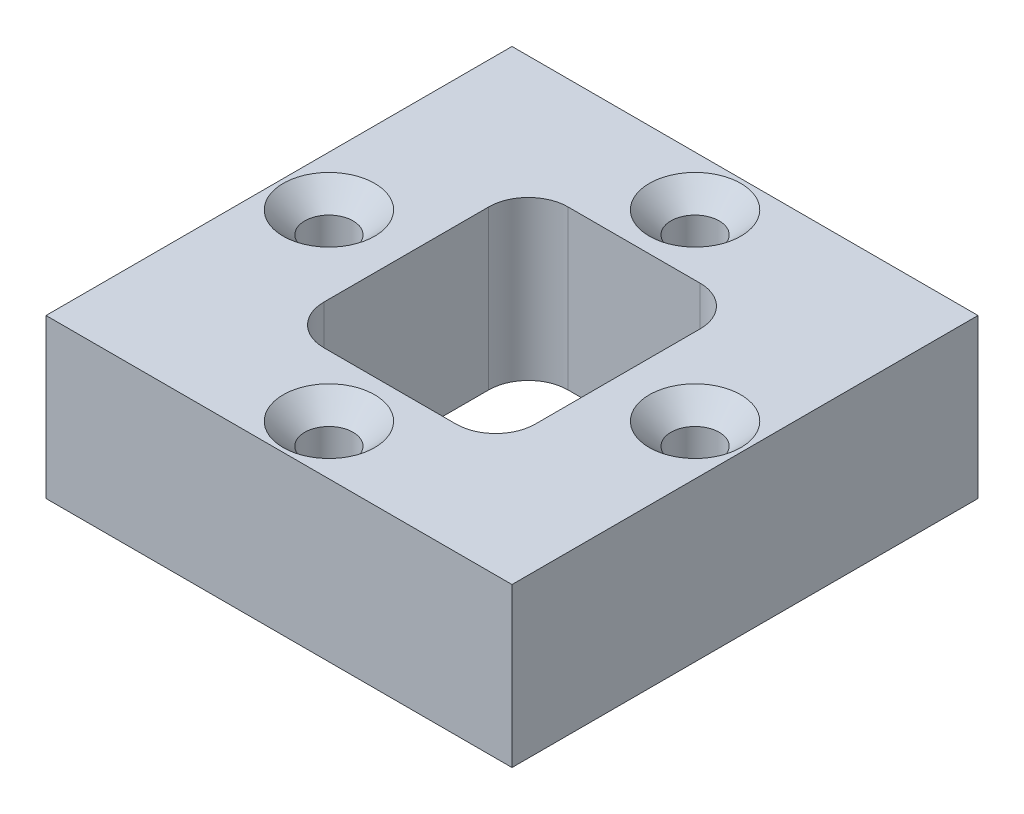
from build123d import *

# Parameters (mm, degrees)
SKETCH2_W                                         = 28
SKETCH2_H                                         = 28
BOSS_EXTRUDE1_DEPTH                               = 9.525
SKETCH6_W                                         = 12.7
SKETCH6_H                                         = 14.66469
CUT_EXTRUDE3_DEPTH                                = 9.525
FILLET1_R                                         = 2.38125
CSK_FOR_M2_5_FLAT_HEAD_MACHINE_SCREW1_D           = 2.9
CSK_FOR_M2_5_FLAT_HEAD_MACHINE_SCREW1_DEPTH       = 10.16
CSK_FOR_M2_5_FLAT_HEAD_MACHINE_SCREW1_CSINK_D     = 5.5
CSK_FOR_M2_5_FLAT_HEAD_MACHINE_SCREW1_CSINK_ANGLE = 90
CSK_FOR_M2_5_FLAT_HEAD_MACHINE_SCREW1_TIP         = 0.871247898


with BuildPart() as part:
    # Sketch2 → Boss-Extrude1 (new body)
    with BuildSketch(Plane(origin=(0, 0, 0), x_dir=(1, 0, 0), z_dir=(0, 1, 0))):
        Rectangle(SKETCH2_W, SKETCH2_H)
    extrude(amount=BOSS_EXTRUDE1_DEPTH)

    # Sketch6 → Cut-Extrude3 (cut)
    with BuildSketch(Plane(origin=(0, 9.525, 0), x_dir=(1, 0, 0), z_dir=(0, 1, 0))):
        Rectangle(SKETCH6_W, SKETCH6_H)
    extrude(amount=-CUT_EXTRUDE3_DEPTH, mode=Mode.SUBTRACT)

    # Fillet1
    fillet1_edges = [part.edges().sort_by_distance(p)[0] for p in [
        (-6.35, 4.7625, 7.332345),
        (-6.35, 4.7625, -7.332345),
        (6.35, 4.7625, -7.332345),
        (6.35, 4.7625, 7.332345),
    ]]
    fillet(fillet1_edges, radius=FILLET1_R)

    # CSK for M2.5 Flat Head Machine Screw1
    with Locations(Plane(origin=(0, 9.525, 0), x_dir=(1, 0, 0), z_dir=(0, 1, 0))):
        with Locations((-11, 0), (0, -11), (11, 0), (0, 11)):
            CounterSinkHole(CSK_FOR_M2_5_FLAT_HEAD_MACHINE_SCREW1_D / 2, CSK_FOR_M2_5_FLAT_HEAD_MACHINE_SCREW1_CSINK_D / 2, depth=CSK_FOR_M2_5_FLAT_HEAD_MACHINE_SCREW1_DEPTH, counter_sink_angle=CSK_FOR_M2_5_FLAT_HEAD_MACHINE_SCREW1_CSINK_ANGLE)
            with Locations((0, 0, -(CSK_FOR_M2_5_FLAT_HEAD_MACHINE_SCREW1_DEPTH + CSK_FOR_M2_5_FLAT_HEAD_MACHINE_SCREW1_TIP / 2))):  # 118° drill point
                Cone(0, CSK_FOR_M2_5_FLAT_HEAD_MACHINE_SCREW1_D / 2, CSK_FOR_M2_5_FLAT_HEAD_MACHINE_SCREW1_TIP, mode=Mode.SUBTRACT)


solid = part.part
